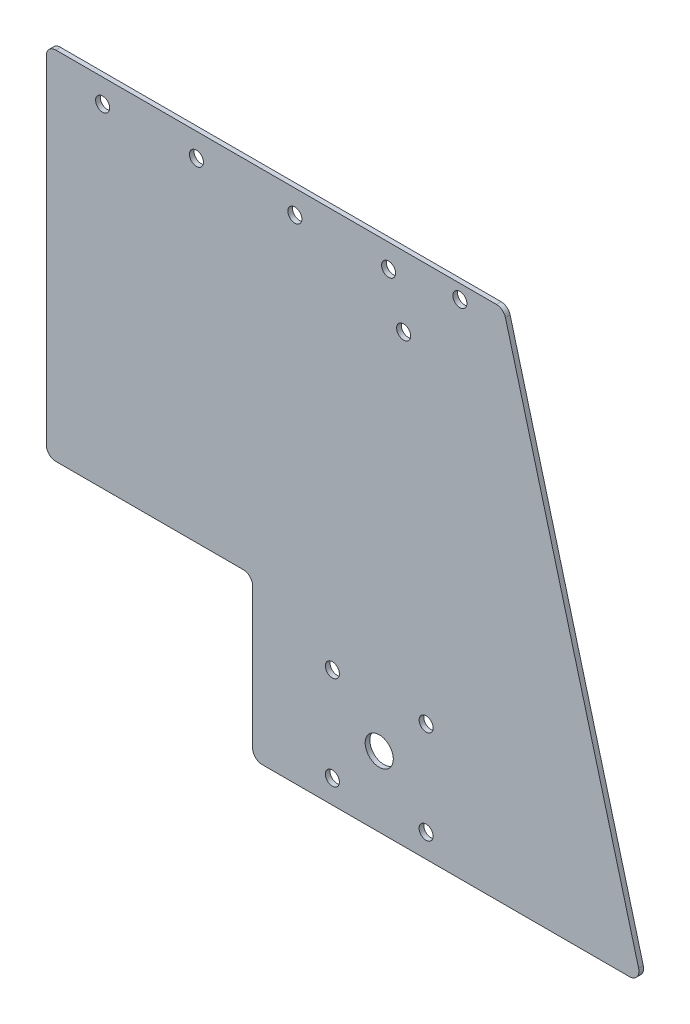
from build123d import *

# Parameters (mm, degrees)
SKETCH_1_R           = 1.5
SKETCH_1_R_2         = 3
EXTRUDE_1_DEPTH      = 1
SKETCH_4_R           = 1.5
CUT_EXTRUDE_2_DEPTH  = 4
SKETCH_5_R           = 1.5
CUT_EXTRUDE_3_DEPTH  = 10
SKETCH_6_W           = 53
SKETCH_6_H           = 34
CUT_EXTRUDE_4_DEPTH  = 10
SKETCH_7_W           = 39
SKETCH_7_H           = 34
CUT_EXTRUDE_5_DEPTH  = 10
SKETCH_10_R          = 10
CUT_EXTRUDE_8_DEPTH  = 10
SKETCH_13_R          = 1.5
CUT_EXTRUDE_10_DEPTH = 1
FILLET_1_R           = 2
EXTRUDE_START        = -1
SKETCH_20_R          = 10
EXTRUDE_3_DEPTH      = 1
SKETCH_21_W          = 48
SKETCH_21_H          = 86
CUT_EXTRUDE_16_DEPTH = 10
FILLET_5_R           = 2


with BuildPart() as part:
    # 草图1 → 凸台-拉伸1 (new body)
    with BuildSketch(Plane.XY):
        Polygon((0, 0), (175, 0), (145.525588833, 110), (0, 110), align=None)
        with Locations((129, 25)):
            Circle(SKETCH_1_R, mode=Mode.SUBTRACT)
        with Locations((129, 5)):
            Circle(SKETCH_1_R, mode=Mode.SUBTRACT)
        with Locations((119, 15)):
            Circle(SKETCH_1_R_2, mode=Mode.SUBTRACT)
        with Locations((109, 5)):
            Circle(SKETCH_1_R, mode=Mode.SUBTRACT)
        with Locations((109, 25)):
            Circle(SKETCH_1_R, mode=Mode.SUBTRACT)
    extrude(amount=EXTRUDE_1_DEPTH)

    # 草图4 → 切除-拉伸2 (cut)
    with BuildSketch(Plane(origin=(0, 0, 0), x_dir=(-1, 0, 0), z_dir=(0, 0, -1))):
        with Locations((-22, 101)):
            Circle(SKETCH_4_R)
        with Locations((-22, 81)):
            Circle(SKETCH_4_R)
        with Locations((-22, 60)):
            Circle(SKETCH_4_R)
        with Locations((-22, 40)):
            Circle(SKETCH_4_R)
    extrude(amount=-CUT_EXTRUDE_2_DEPTH, mode=Mode.SUBTRACT)

    # 草图5 → 切除-拉伸3 (cut)
    with BuildSketch(Plane(origin=(0, 0, 0), x_dir=(-1, 0, 0), z_dir=(0, 0, -1))):
        with Locations((-136.2, 107)):
            Circle(SKETCH_5_R)
        with Locations((-124.2, 95)):
            Circle(SKETCH_5_R)
    extrude(amount=-CUT_EXTRUDE_3_DEPTH, mode=Mode.SUBTRACT)

    # 草图6 → 切除-拉伸4 (cut)
    with BuildSketch(Plane.XY.offset(1)):
        with Locations((26.5, 17)):
            Rectangle(SKETCH_6_W, SKETCH_6_H)
    extrude(amount=-CUT_EXTRUDE_4_DEPTH, mode=Mode.SUBTRACT)

    # 草图7 → 切除-拉伸5 (cut)
    with BuildSketch(Plane.XY.offset(1)):
        with Locations((72.5, 17)):
            Rectangle(SKETCH_7_W, SKETCH_7_H)
    extrude(amount=-CUT_EXTRUDE_5_DEPTH, mode=Mode.SUBTRACT)

    # 草图10 → 切除-拉伸8 (cut)
    with BuildSketch(Plane.XY.offset(1)):
        with Locations((37, 94)):
            Circle(SKETCH_10_R)
    extrude(amount=-CUT_EXTRUDE_8_DEPTH, mode=Mode.SUBTRACT)

    # 草图13 → 切除-拉伸10 (cut)
    with BuildSketch(Plane.XY.offset(1)):
        with Locations((121, 105)):
            Circle(SKETCH_13_R)
        with Locations((101, 105)):
            Circle(SKETCH_13_R)
        with Locations((80, 105)):
            Circle(SKETCH_13_R)
        with Locations((60, 105)):
            Circle(SKETCH_13_R)
        with Locations((45, 105)):
            Circle(SKETCH_13_R)
        with Locations((25, 105)):
            Circle(SKETCH_13_R)
    extrude(amount=-CUT_EXTRUDE_10_DEPTH, mode=Mode.SUBTRACT)

    # 圆角1
    fillet_1_edges = [part.edges().sort_by_distance(p)[0] for p in [
        (0, 34, 0.5),
        (0, 110, 0.5),
        (145.525588833, 110, 0.5),
        (175, 0, 0.5),
        (92, 34, 0.5),
        (92, 0, 0.5),
    ]]
    fillet(fillet_1_edges, radius=FILLET_1_R)

    # 草图20 → 凸台-拉伸3 (add)
    with BuildSketch(Plane(origin=(0, 0, 0), x_dir=(-1, 0, 0), z_dir=(0, 0, -1)).offset(EXTRUDE_START)):
        with Locations((-37, 94)):
            Circle(SKETCH_20_R)
    extrude(amount=EXTRUDE_3_DEPTH)

    # 草图21 → 切除-拉伸16 (cut)
    with BuildSketch(Plane(origin=(0, 0, 0), x_dir=(-1, 0, 0), z_dir=(0, 0, -1))):
        with Locations((-24, 77)):
            Rectangle(SKETCH_21_W, SKETCH_21_H)
    extrude(amount=-CUT_EXTRUDE_16_DEPTH, mode=Mode.SUBTRACT)

    # 圆角5
    fillet_5_edges = [part.edges().sort_by_distance(p)[0] for p in [
        (48, 34, 0.5),
        (48, 110, 0.5),
    ]]
    fillet(fillet_5_edges, radius=FILLET_5_R)


solid = part.part
